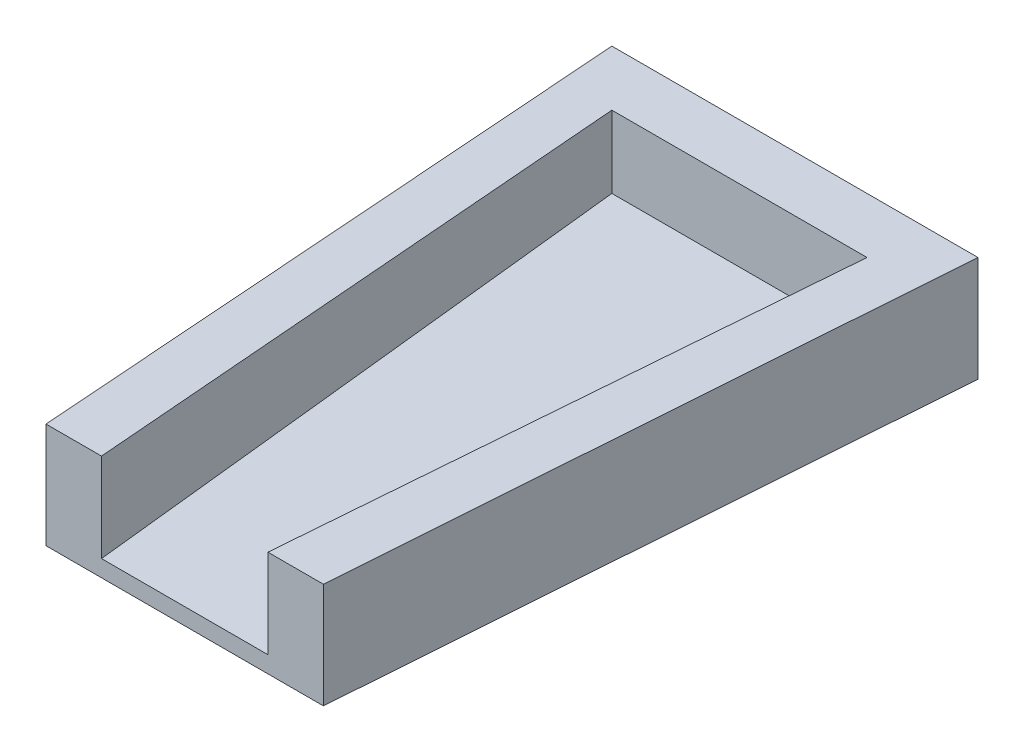
from build123d import *

# Parameters (mm, degrees)
CORTE_MEIO_DEPTH      = 12.640446866
CORTE_MEIO_DEPTH_BACK = 12.640446866
ESBO_O3_W             = 10.701271156
ESBO_O3_H             = 3.779396545


with BuildPart() as part:
    # Esboço1 → Loft1 section 0
    with BuildSketch(Plane.XY):
        with BuildLine():
            Line((-3.3, -1.9), (3.3, -1.9))
            Line((3.3, -1.9), (3.3, 1.9))
            Line((3.3, 1.9), (-3.3, 1.9))
            Line((-3.3, 1.9), (-3.3, -1.9))
        make_face()
    # Esboço2 → Loft1 section 1
    with BuildSketch(Plane.XY.offset(11)):
        with BuildLine():
            Line((-2.5, -1.9), (2.5, -1.9))
            Line((2.5, -1.9), (2.5, 1.9))
            Line((2.5, 1.9), (-2.5, 1.9))
            Line((-2.5, 1.9), (-2.5, -1.9))
        make_face()
    loft()

    # Esboço3 → Corte Meio (cut, two sides: drawn at the far end of the back side and taken through both)
    with BuildSketch(Plane.XY.offset(-CORTE_MEIO_DEPTH_BACK)):
        with Locations((0.988815263, 1.889698273)):
            Rectangle(ESBO_O3_W, ESBO_O3_H)
    extrude(amount=CORTE_MEIO_DEPTH + CORTE_MEIO_DEPTH_BACK, mode=Mode.SUBTRACT)

    # Esboço6 → Loft de corte1 section 0
    with BuildSketch(Plane.XY.offset(11)):
        with BuildLine():
            Line((-1.5, -1.6), (1.5, -1.6))
            Line((1.5, -1.6), (1.5, 1.6))
            Line((1.5, 1.6), (-1.5, 1.6))
            Line((-1.5, 1.6), (-1.5, -1.6))
        make_face()
    # Esboço5 → Loft de corte1 section 1
    with BuildSketch(Plane.XY.offset(1)):
        with BuildLine():
            Line((2.3, -1.3), (-2.3, -1.3))
            Line((-2.3, -1.3), (-2.3, 1.3))
            Line((-2.3, 1.3), (2.3, 1.3))
            Line((2.3, 1.3), (2.3, -1.3))
        make_face()
    loft(mode=Mode.SUBTRACT)


solid = part.part
